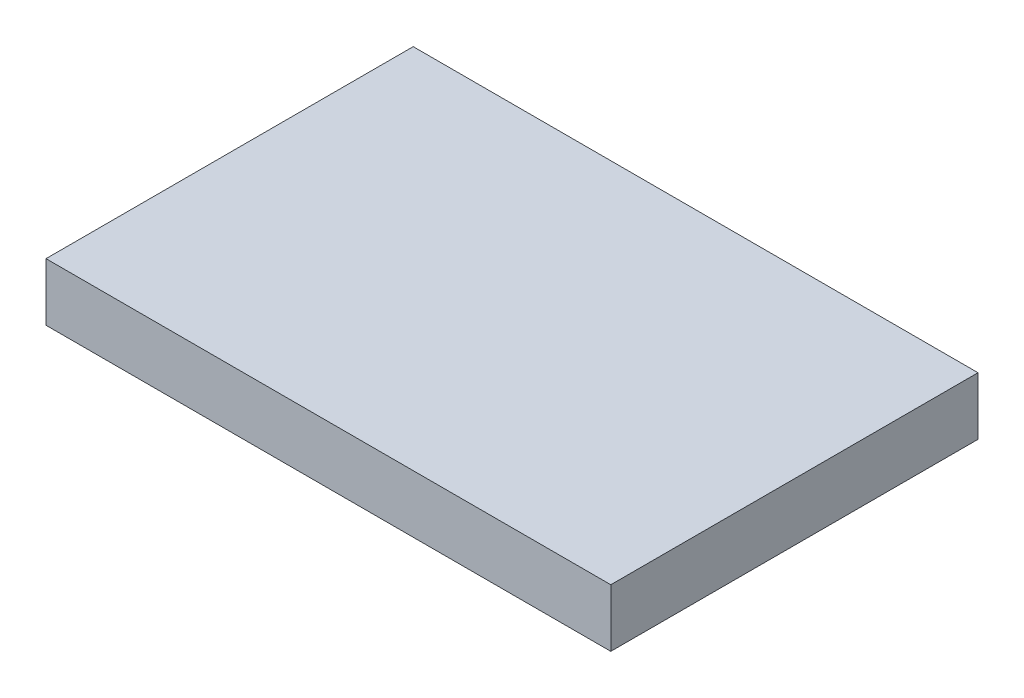
from build123d import *

# Parameters (mm, degrees)
SKETCH1_W           = 82.042
SKETCH1_H           = 53.34
BOSS_EXTRUDE1_DEPTH = 8.382


with BuildPart() as part:
    # Sketch1 → Boss-Extrude1 (new body)
    with BuildSketch(Plane(origin=(0, 0, 0), x_dir=(1, 0, 0), z_dir=(0, 1, 0))):
        with Locations((41.021, -26.67)):
            Rectangle(SKETCH1_W, SKETCH1_H)
    extrude(amount=BOSS_EXTRUDE1_DEPTH)


solid = part.part
